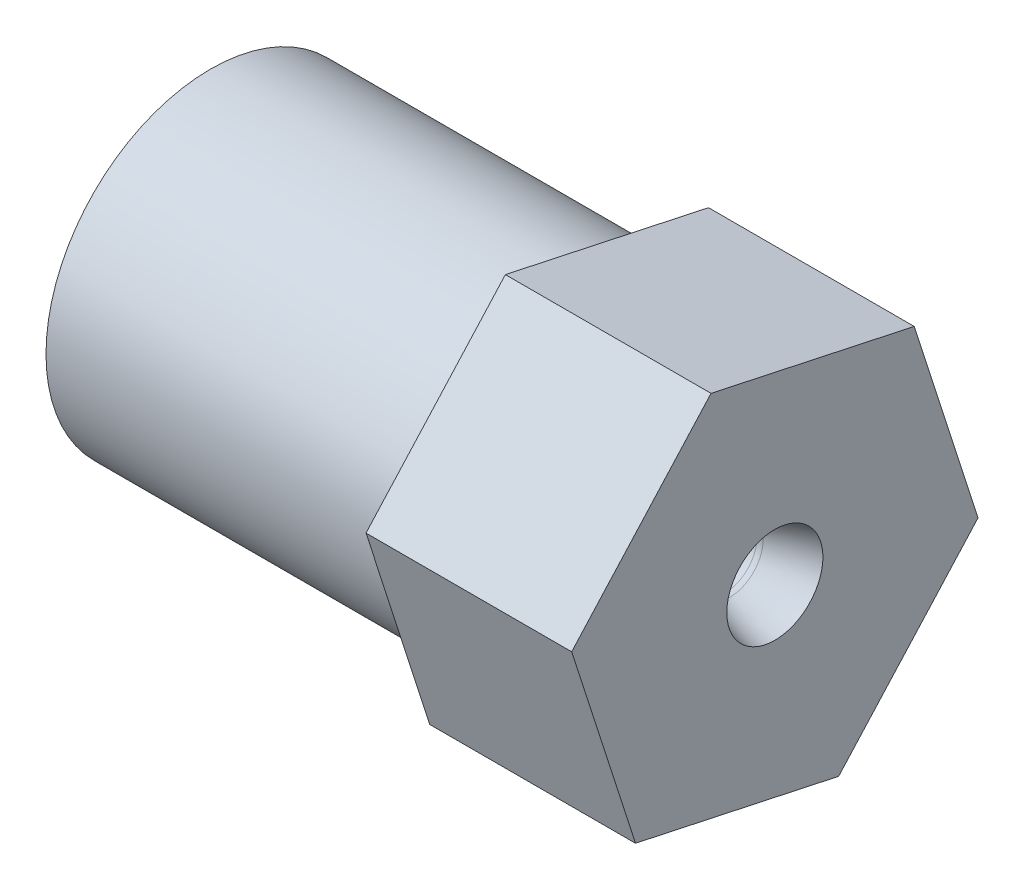
from build123d import *

# Parameters (mm, degrees)
SKETCH4_R           = 10.16
BOSS_EXTRUDE1_DEPTH = 12.7
FILLET1_R           = 0.635


with BuildPart() as part:
    # Sketch1 → Revolve1 (revolve)
    with BuildSketch(Plane.XY, mode=Mode.PRIVATE) as revolve1_sk:
        with BuildLine():
            Line((-2.121320344, 2.878679656), (-2.757704717, 3.51506403))
            ThreePointArc((-2.757704717, 3.51506403), (-3.78774885, 4.203317516), (-5.002768748, 4.445))
            Line((-5.002768748, 4.445), (-13.462, 4.445))
            Line((-13.462, 4.445), (-13.462, 4.699))
            ThreePointArc((-13.462, 4.699), (-13.499197439, 4.788802561), (-13.589, 4.826))
            Line((-13.589, 4.826), (-19.304, 4.826))
            ThreePointArc((-19.304, 4.826), (-19.753012806, 5.011987194), (-19.939, 5.461))
            Line((-19.939, 5.461), (-19.939, 6.8199))
            ThreePointArc((-19.939, 6.8199), (-19.976197439, 6.909702561), (-20.066, 6.9469))
            Line((-20.066, 6.9469), (-24.892, 6.9469))
            Line((-24.892, 6.9469), (-24.892, 7.8994))
            ThreePointArc((-24.892, 7.8994), (-24.929197439, 7.989202561), (-25.019, 8.0264))
            Line((-25.019, 8.0264), (-31.115, 8.0264))
            ThreePointArc((-31.115, 8.0264), (-31.564012806, 8.212387194), (-31.75, 8.6614))
            Line((-31.75, 8.6614), (-31.75, 10.16))
            Line((-31.75, 10.16), (-9.602281293, 10.16))
            Line((-9.602281293, 10.16), (3.097718707, 10.16))
            Line((3.097718707, 10.16), (3.097718707, 2.966479395))
            add(Edge.make_bspline(
                [(3.097718707, 2.966479395), (1.65491745, 2.633382479), (0.312584903, 2.063596117)],
                knots=[0, 0, 0, 1, 1, 1], degree=2))
            ThreePointArc((0.312584903, 2.063596117), (0.159494348, 2.016060236), (0, 2))
            ThreePointArc((0, 2), (-1.148050297, 2.228361402), (-2.121320344, 2.878679656))
        make_face()
    revolve(revolve1_sk.sketch.rotate(Axis((0, 0, 0), (1, 0, 0)), 90), axis=Axis((0, 0, 0), (1, 0, 0)))

    # Sketch4 → Boss-Extrude1 (add)
    with BuildSketch(Plane(origin=(3.097718707, 0, 0), x_dir=(0, 0, -1), z_dir=(1, 0, 0))):
        Polygon((3.940411868, -12.211607701), (12.545768424, -2.693307071), (8.605356556, 9.51830063), (-3.940411868, 12.211607701), (-12.545768424, 2.693307071), (-8.605356556, -9.51830063), align=None)
        with Locations(Location((0, 0, 0), (0, 0, 180))):
            Circle(SKETCH4_R, mode=Mode.SUBTRACT)
    extrude(amount=-BOSS_EXTRUDE1_DEPTH)

    # Fillet1
    fillet1_edges = [part.edges().sort_by_distance(p)[0] for p in [
        (-9.602281293, 0, -10.16),
    ]]
    fillet(fillet1_edges, radius=FILLET1_R)


solid = part.part
